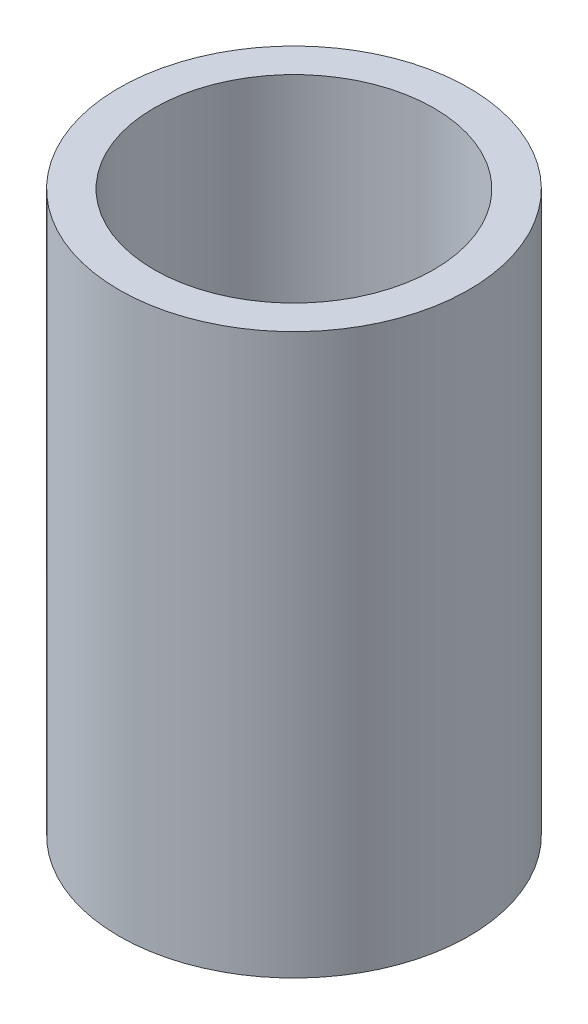
from build123d import *

# Parameters (mm, degrees)
SKETCH_1_R      = 5
SKETCH_1_R_2    = 4
EXTRUDE_1_DEPTH = 16


with BuildPart() as part:
    # Эскиз1 → Бобышка-Вытянуть1 (new body)
    with BuildSketch(Plane(origin=(0, 0, 0), x_dir=(1, 0, 0), z_dir=(0, 1, 0))):
        with Locations(Location((0, 0, 0), (0, 0, 270))):
            Circle(SKETCH_1_R)
        with Locations(Location((0, 0, 0), (0, 0, 270))):
            Circle(SKETCH_1_R_2, mode=Mode.SUBTRACT)
    extrude(amount=EXTRUDE_1_DEPTH)


solid = part.part
